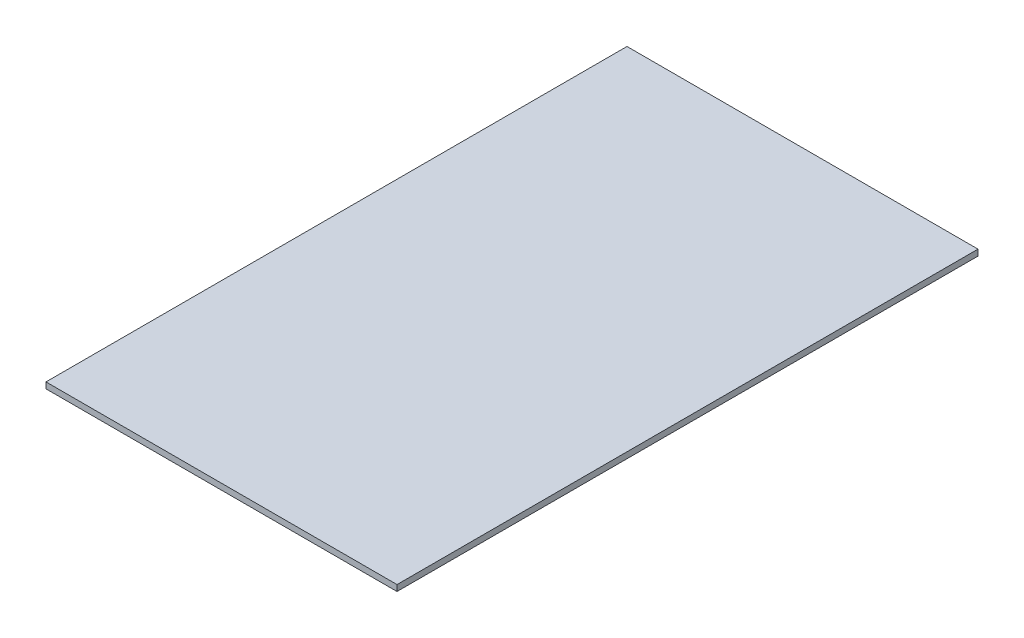
from build123d import *

# Parameters (mm, degrees)
SKETCH1_W           = 184.15
SKETCH1_H           = 304.8
BOSS_EXTRUDE1_DEPTH = 3.175


with BuildPart() as part:
    # Sketch1 → Boss-Extrude1 (new body)
    with BuildSketch(Plane(origin=(0, 0, 0), x_dir=(1, 0, 0), z_dir=(0, 1, 0))):
        with Locations((92.075, 152.4)):
            Rectangle(SKETCH1_W, SKETCH1_H)
    extrude(amount=BOSS_EXTRUDE1_DEPTH)


solid = part.part
